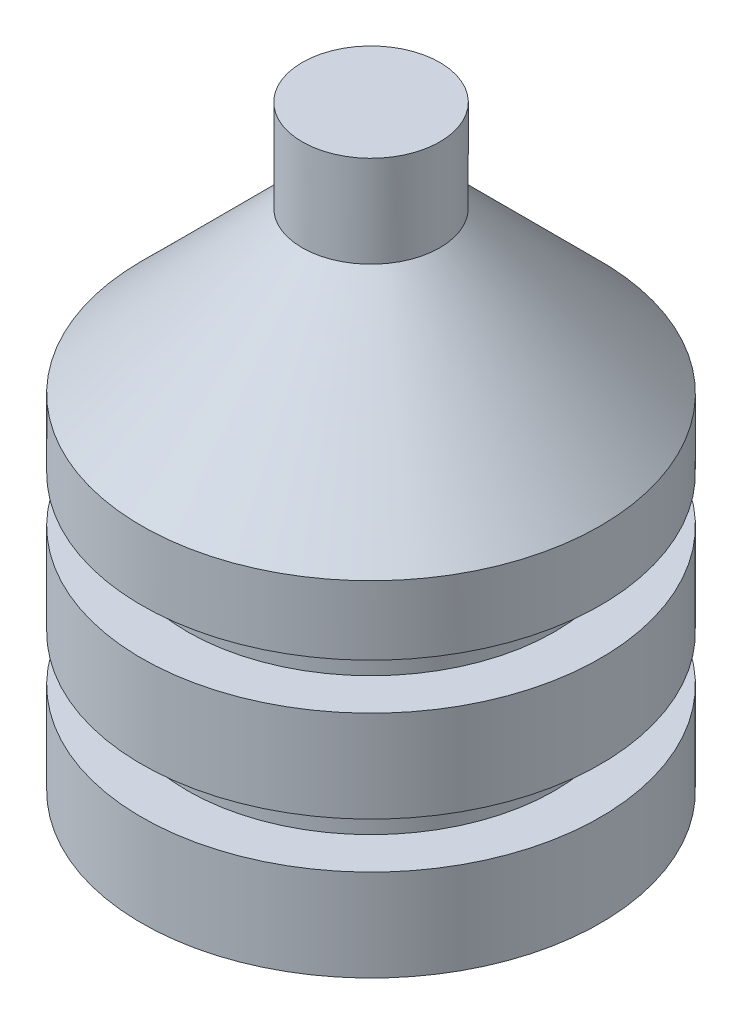
from build123d import *


with BuildPart() as part:
    # Sketch3 → Revolve4 (revolve)
    with BuildSketch(Plane.XY):
        Polygon((0, 113.59375), (0, -16.40625), (-50, -16.40625), (-50, 3.59375), (-40, 3.59375), (-40, 13.59375), (-50, 13.59375), (-50, 33.59375), (-40, 33.59375), (-40, 43.59375), (-50, 43.59375), (-50, 58.59375), (-15, 93.59375), (-15, 113.59375), align=None)
    revolve(axis=Axis((0, 113.59375, 0), (0, -1, 0)))


solid = part.part
